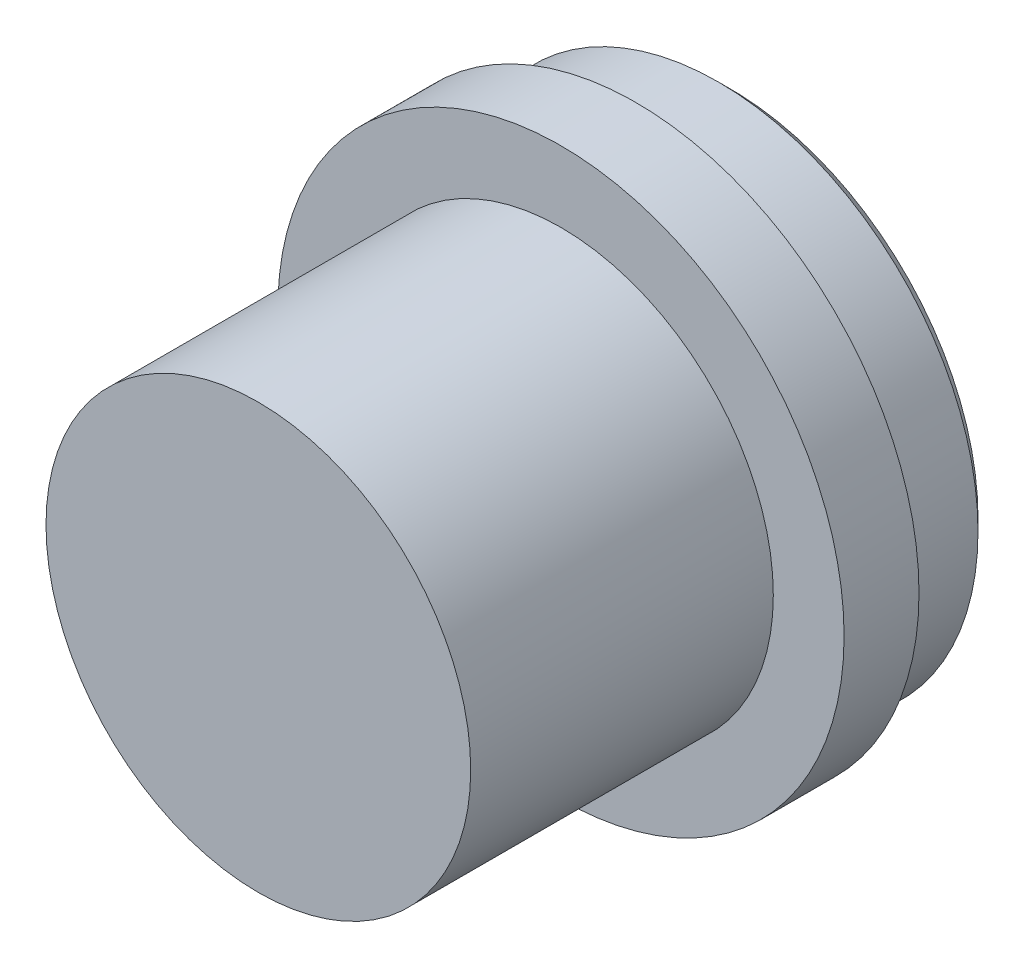
from build123d import *

# Parameters (mm, degrees)
CHAMFER1_SIZE = 0.5


with BuildPart() as part:
    # Sketch1 → Revolve1 (revolve)
    with BuildSketch(Plane(origin=(0, 0, 0), x_dir=(1, 0, 0), z_dir=(0, 1, 0))):
        Polygon((9, -20), (0, -20), (0, 0), (11, 0), (11, -4), (12, -4), (12, -7.175), (9, -7.175), align=None)
    revolve(axis=Axis((0, 0, 20), (0, 0, -1)))

    # Chamfer1
    chamfer1_edges = [part.edges().sort_by_distance(p)[0] for p in [
        (-11, 0, 0),
    ]]
    chamfer(chamfer1_edges, length=CHAMFER1_SIZE)


solid = part.part
